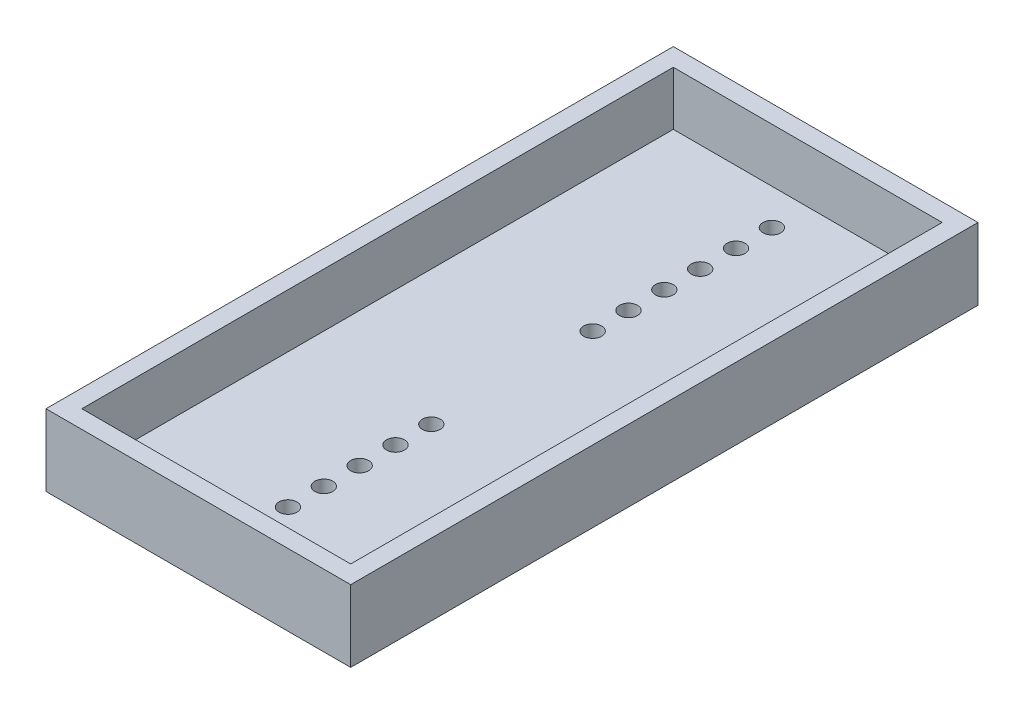
from build123d import *

# Parameters (mm, degrees)
SKETCH_1_W          = 17
SKETCH_1_H          = 35
SKETCH_1_W_2        = 15
SKETCH_1_H_2        = 33
EXTRUDE_1_DEPTH     = 4
SKETCH_1_2_W        = 15
SKETCH_1_2_H        = 33
EXTRUDE_2_DEPTH     = 1
SKETCH_2_R          = 0.5
CUT_EXTRUDE_1_DEPTH = 20.862024066


with BuildPart() as part:
    # 草图1 → 凸台-拉伸1 (new body)
    with BuildSketch(Plane(origin=(0, 0, 0), x_dir=(1, 0, 0), z_dir=(0, 1, 0))):
        Rectangle(SKETCH_1_W, SKETCH_1_H)
        Rectangle(SKETCH_1_W_2, SKETCH_1_H_2, mode=Mode.SUBTRACT)
    extrude(amount=EXTRUDE_1_DEPTH)

    # 草图1<2> → 凸台-拉伸2 (add)
    with BuildSketch(Plane(origin=(0, 0, 0), x_dir=(1, 0, 0), z_dir=(0, 1, 0))):
        Rectangle(SKETCH_1_2_W, SKETCH_1_2_H)
    extrude(amount=EXTRUDE_2_DEPTH)

    # 草图2 → 切除-拉伸1 (cut, through all)
    with BuildSketch(Plane.XZ):
        with Locations((0, 14.5)):
            Circle(SKETCH_2_R)
        with Locations((0, 12.5)):
            Circle(SKETCH_2_R)
        with Locations((0, 10.5)):
            Circle(SKETCH_2_R)
        with Locations((0, 8.5)):
            Circle(SKETCH_2_R)
        with Locations((0, 6.5)):
            Circle(SKETCH_2_R)
        with Locations((0, 4.5)):
            Circle(SKETCH_2_R)
        with Locations((0, -4.5)):
            Circle(SKETCH_2_R)
        with Locations((0, -6.5)):
            Circle(SKETCH_2_R)
        with Locations((0, -8.5)):
            Circle(SKETCH_2_R)
        with Locations((0, -10.5)):
            Circle(SKETCH_2_R)
        with Locations((0, -12.5)):
            Circle(SKETCH_2_R)
        with Locations((0, -14.5)):
            Circle(SKETCH_2_R)
    extrude(amount=-CUT_EXTRUDE_1_DEPTH, mode=Mode.SUBTRACT)


solid = part.part
